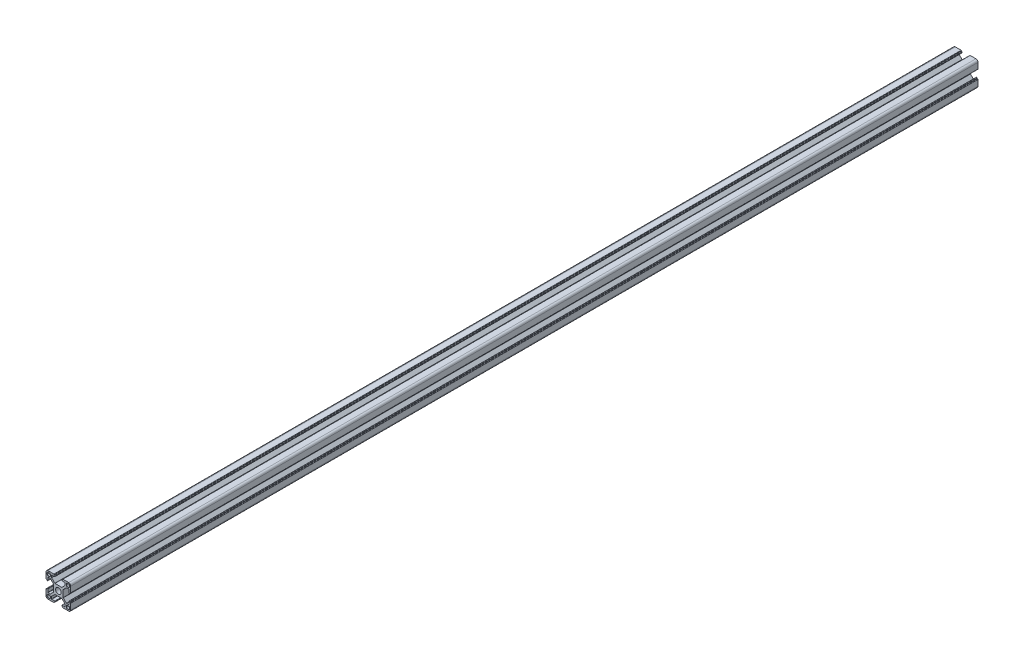
from build123d import *

# Parameters (mm, degrees)
MODEL_R             = 6.8
BOSS_EXTRUDE1_DEPTH = 2200
SCALE1_SCALE        = 0.5


with BuildPart() as part:
    # Model → Boss-Extrude1 (new body)
    with BuildSketch(Plane.XY):
        with BuildLine():
            Line((0, 11.6), (-8.240202025, 11.6))
            ThreePointArc((-8.240202025, 11.6), (-8.469812085, 11.64567228), (-8.664466094, 11.775735931))
            Line((-8.664466094, 11.775735931), (-16.324264069, 19.435533906))
            ThreePointArc((-16.324264069, 19.435533906), (-16.45432772, 19.630187915), (-16.5, 19.859797975))
            Line((-16.5, 19.859797975), (-16.5, 25))
            ThreePointArc((-16.5, 25), (-16.324264069, 25.424264069), (-15.9, 25.6))
            Line((-15.9, 25.6), (-8.8, 25.6))
            ThreePointArc((-8.8, 25.6), (-8.375735931, 25.775735931), (-8.2, 26.2))
            Line((-8.2, 26.2), (-8.2, 27.4))
            ThreePointArc((-8.2, 27.4), (-8.375735931, 27.824264069), (-8.8, 28))
            Line((-8.8, 28), (-9.8, 28))
            ThreePointArc((-9.8, 28), (-10.224264069, 28.175735931), (-10.4, 28.6))
            Line((-10.4, 28.6), (-10.4, 29.4))
            ThreePointArc((-10.4, 29.4), (-10.575735931, 29.824264069), (-10.999999999, 30))
            Line((-10.999999999, 30), (-25, 30))
            ThreePointArc((-25, 30), (-28.535533906, 28.535533906), (-30, 25))
            Line((-30, 25), (-30, 11))
            ThreePointArc((-30, 11), (-29.824264069, 10.575735931), (-29.4, 10.4))
            Line((-29.4, 10.4), (-28.6, 10.4))
            ThreePointArc((-28.6, 10.4), (-28.175735931, 10.224264069), (-28, 9.8))
            Line((-28, 9.8), (-28, 8.8))
            ThreePointArc((-28, 8.8), (-27.824264069, 8.375735931), (-27.4, 8.2))
            Line((-27.4, 8.2), (-26.2, 8.2))
            ThreePointArc((-26.2, 8.2), (-25.775735931, 8.375735931), (-25.6, 8.8))
            Line((-25.6, 8.8), (-25.6, 15.9))
            ThreePointArc((-25.6, 15.9), (-25.424264069, 16.324264069), (-25, 16.5))
            Line((-25, 16.5), (-19.859797974, 16.5))
            ThreePointArc((-19.859797974, 16.5), (-19.630187915, 16.454327719), (-19.435533906, 16.324264068))
            Line((-19.435533906, 16.324264068), (-11.775735931, 8.664466094))
            ThreePointArc((-11.775735931, 8.664466094), (-11.64567228, 8.469812085), (-11.6, 8.240202025))
            Line((-11.6, 8.240202025), (-11.6, 0))
            Line((-11.6, 0), (-11.6, -8.240202025))
            ThreePointArc((-11.6, -8.240202025), (-11.64567228, -8.469812085), (-11.775735931, -8.664466094))
            Line((-11.775735931, -8.664466094), (-19.435533906, -16.324264068))
            ThreePointArc((-19.435533906, -16.324264068), (-19.630187915, -16.454327719), (-19.859797974, -16.5))
            Line((-19.859797974, -16.5), (-25, -16.5))
            ThreePointArc((-25, -16.5), (-25.424264069, -16.324264069), (-25.6, -15.9))
            Line((-25.6, -15.9), (-25.6, -8.8))
            ThreePointArc((-25.6, -8.8), (-25.775735931, -8.375735931), (-26.2, -8.2))
            Line((-26.2, -8.2), (-27.4, -8.2))
            ThreePointArc((-27.4, -8.2), (-27.824264069, -8.375735931), (-28, -8.8))
            Line((-28, -8.8), (-28, -9.8))
            ThreePointArc((-28, -9.8), (-28.175735931, -10.224264069), (-28.6, -10.4))
            Line((-28.6, -10.4), (-29.4, -10.4))
            ThreePointArc((-29.4, -10.4), (-29.824264069, -10.575735931), (-30, -11))
            Line((-30, -11), (-30, -25))
            ThreePointArc((-30, -25), (-28.535533906, -28.535533906), (-25, -30))
            Line((-25, -30), (-10.999999999, -30))
            ThreePointArc((-10.999999999, -30), (-10.575735931, -29.824264069), (-10.4, -29.4))
            Line((-10.4, -29.4), (-10.4, -28.6))
            ThreePointArc((-10.4, -28.6), (-10.224264069, -28.175735931), (-9.8, -28))
            Line((-9.8, -28), (-8.8, -28))
            ThreePointArc((-8.8, -28), (-8.375735931, -27.824264069), (-8.2, -27.4))
            Line((-8.2, -27.4), (-8.2, -26.2))
            ThreePointArc((-8.2, -26.2), (-8.375735931, -25.775735931), (-8.8, -25.6))
            Line((-8.8, -25.6), (-15.9, -25.6))
            ThreePointArc((-15.9, -25.6), (-16.324264069, -25.424264069), (-16.5, -25))
            Line((-16.5, -25), (-16.5, -19.859797975))
            ThreePointArc((-16.5, -19.859797975), (-16.45432772, -19.630187915), (-16.324264069, -19.435533906))
            Line((-16.324264069, -19.435533906), (-8.664466094, -11.775735931))
            ThreePointArc((-8.664466094, -11.775735931), (-8.469812085, -11.64567228), (-8.240202025, -11.6))
            Line((-8.240202025, -11.6), (0, -11.6))
            Line((0, -11.6), (8.240202025, -11.6))
            ThreePointArc((8.240202025, -11.6), (8.469812085, -11.64567228), (8.664466094, -11.775735931))
            Line((8.664466094, -11.775735931), (16.324264069, -19.435533906))
            ThreePointArc((16.324264069, -19.435533906), (16.45432772, -19.630187915), (16.5, -19.859797975))
            Line((16.5, -19.859797975), (16.5, -25))
            ThreePointArc((16.5, -25), (16.324264069, -25.424264069), (15.9, -25.6))
            Line((15.9, -25.6), (8.8, -25.6))
            ThreePointArc((8.8, -25.6), (8.375735931, -25.775735931), (8.2, -26.2))
            Line((8.2, -26.2), (8.2, -27.4))
            ThreePointArc((8.2, -27.4), (8.375735931, -27.824264069), (8.8, -28))
            Line((8.8, -28), (9.8, -28))
            ThreePointArc((9.8, -28), (10.224264069, -28.175735931), (10.4, -28.6))
            Line((10.4, -28.6), (10.4, -29.4))
            ThreePointArc((10.4, -29.4), (10.575735931, -29.824264069), (10.999999999, -30))
            Line((10.999999999, -30), (25, -30))
            ThreePointArc((25, -30), (28.535533906, -28.535533906), (30, -25))
            Line((30, -25), (30, -11))
            ThreePointArc((30, -11), (29.824264069, -10.575735931), (29.4, -10.4))
            Line((29.4, -10.4), (28.6, -10.4))
            ThreePointArc((28.6, -10.4), (28.175735931, -10.224264069), (28, -9.8))
            Line((28, -9.8), (28, -8.8))
            ThreePointArc((28, -8.8), (27.824264069, -8.375735931), (27.4, -8.2))
            Line((27.4, -8.2), (26.2, -8.2))
            ThreePointArc((26.2, -8.2), (25.775735931, -8.375735931), (25.6, -8.8))
            Line((25.6, -8.8), (25.6, -15.9))
            ThreePointArc((25.6, -15.9), (25.424264069, -16.324264069), (25, -16.5))
            Line((25, -16.5), (19.859797974, -16.5))
            ThreePointArc((19.859797974, -16.5), (19.630187915, -16.454327719), (19.435533906, -16.324264068))
            Line((19.435533906, -16.324264068), (11.775735931, -8.664466094))
            ThreePointArc((11.775735931, -8.664466094), (11.64567228, -8.469812085), (11.6, -8.240202025))
            Line((11.6, -8.240202025), (11.6, 0))
            Line((11.6, 0), (11.6, 8.240202025))
            ThreePointArc((11.6, 8.240202025), (11.64567228, 8.469812085), (11.775735931, 8.664466094))
            Line((11.775735931, 8.664466094), (19.611269837, 16.5))
            Line((19.611269837, 16.5), (25, 16.5))
            ThreePointArc((25, 16.5), (25.424264069, 16.324264069), (25.6, 15.9))
            Line((25.6, 15.9), (25.6, 8.8))
            ThreePointArc((25.6, 8.8), (25.775735931, 8.375735931), (26.2, 8.2))
            Line((26.2, 8.2), (27.4, 8.2))
            ThreePointArc((27.4, 8.2), (27.824264069, 8.375735931), (28, 8.8))
            Line((28, 8.8), (28, 9.8))
            ThreePointArc((28, 9.8), (28.175735931, 10.224264069), (28.6, 10.4))
            Line((28.6, 10.4), (29.4, 10.4))
            ThreePointArc((29.4, 10.4), (29.824264069, 10.575735931), (30, 11))
            Line((30, 11), (30, 25))
            ThreePointArc((30, 25), (28.535533906, 28.535533906), (25, 30))
            Line((25, 30), (10.999999999, 30))
            ThreePointArc((10.999999999, 30), (10.575735931, 29.824264069), (10.4, 29.4))
            Line((10.4, 29.4), (10.4, 28.6))
            ThreePointArc((10.4, 28.6), (10.224264069, 28.175735931), (9.8, 28))
            Line((9.8, 28), (8.8, 28))
            ThreePointArc((8.8, 28), (8.375735931, 27.824264069), (8.2, 27.4))
            Line((8.2, 27.4), (8.2, 26.2))
            ThreePointArc((8.2, 26.2), (8.375735931, 25.775735931), (8.8, 25.6))
            Line((8.8, 25.6), (15.9, 25.6))
            ThreePointArc((15.9, 25.6), (16.324264069, 25.424264069), (16.5, 25))
            Line((16.5, 25), (16.5, 19.859797975))
            ThreePointArc((16.5, 19.859797975), (16.45432772, 19.630187915), (16.324264069, 19.435533906))
            Line((16.324264069, 19.435533906), (8.664466094, 11.775735931))
            ThreePointArc((8.664466094, 11.775735931), (8.469812085, 11.64567228), (8.240202025, 11.6))
            Line((8.240202025, 11.6), (0, 11.6))
        make_face()
        Circle(MODEL_R, mode=Mode.SUBTRACT)
        with BuildLine():
            Line((21.5, 27), (25, 27))
            ThreePointArc((25, 27), (26.414213562, 26.414213562), (27, 25))
            Line((27, 25), (27, 21.5))
            ThreePointArc((27, 21.5), (26.414213562, 20.085786438), (25, 19.5))
            Line((25, 19.5), (21.5, 19.5))
            ThreePointArc((21.5, 19.5), (20.085786438, 20.085786438), (19.5, 21.5))
            Line((19.5, 21.5), (19.5, 25))
            ThreePointArc((19.5, 25), (20.085786438, 26.414213562), (21.5, 27))
        make_face(mode=Mode.SUBTRACT)
        with BuildLine():
            Line((21.5, -27), (25, -27))
            ThreePointArc((25, -27), (26.414213562, -26.414213562), (27, -25))
            Line((27, -25), (27, -21.5))
            ThreePointArc((27, -21.5), (26.414213562, -20.085786438), (25, -19.5))
            Line((25, -19.5), (21.5, -19.5))
            ThreePointArc((21.5, -19.5), (20.085786438, -20.085786438), (19.5, -21.5))
            Line((19.5, -21.5), (19.5, -25))
            ThreePointArc((19.5, -25), (20.085786438, -26.414213562), (21.5, -27))
        make_face(mode=Mode.SUBTRACT)
        with BuildLine():
            Line((-21.5, -27), (-25, -27))
            ThreePointArc((-25, -27), (-26.414213562, -26.414213562), (-27, -25))
            Line((-27, -25), (-27, -21.5))
            ThreePointArc((-27, -21.5), (-26.414213562, -20.085786438), (-25, -19.5))
            Line((-25, -19.5), (-21.5, -19.5))
            ThreePointArc((-21.5, -19.5), (-20.085786438, -20.085786438), (-19.5, -21.5))
            Line((-19.5, -21.5), (-19.5, -25))
            ThreePointArc((-19.5, -25), (-20.085786438, -26.414213562), (-21.5, -27))
        make_face(mode=Mode.SUBTRACT)
        with BuildLine():
            Line((-21.5, 27), (-25, 27))
            ThreePointArc((-25, 27), (-26.414213562, 26.414213562), (-27, 25))
            Line((-27, 25), (-27, 21.5))
            ThreePointArc((-27, 21.5), (-26.414213562, 20.085786438), (-25, 19.5))
            Line((-25, 19.5), (-21.5, 19.5))
            ThreePointArc((-21.5, 19.5), (-20.085786438, 20.085786438), (-19.5, 21.5))
            Line((-19.5, 21.5), (-19.5, 25))
            ThreePointArc((-19.5, 25), (-20.085786438, 26.414213562), (-21.5, 27))
        make_face(mode=Mode.SUBTRACT)
    extrude(amount=BOSS_EXTRUDE1_DEPTH)


with BuildPart() as part_1:
    # Scale1: scaled about (-0.000116359, -9.761e-05, 1100)
    add(part.part.scale(SCALE1_SCALE).moved(Location((-5.818e-05, -4.8805e-05, 550))))


solid = part_1.part
